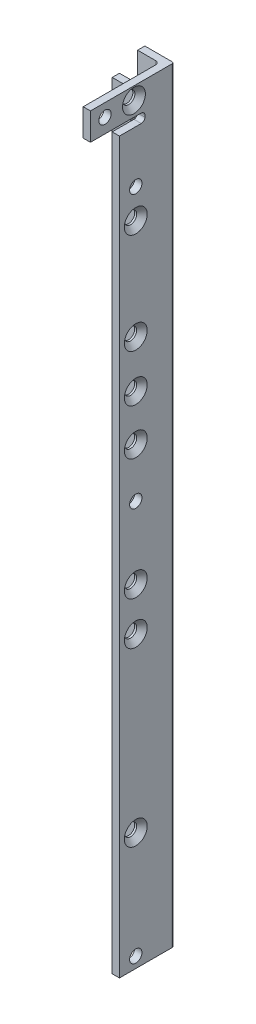
from build123d import *

# Parameters (mm, degrees)
BOSS_EXTRUDE1_DEPTH                             = 211
CSK_FOR_M3_FLAT_HEAD_MACHINE_SCREW1_D           = 3.4
CSK_FOR_M3_FLAT_HEAD_MACHINE_SCREW1_CSINK_D     = 6.3
CSK_FOR_M3_FLAT_HEAD_MACHINE_SCREW1_CSINK_ANGLE = 90
SKETCH5_W                                       = 7
SKETCH5_H                                       = 10
CUT_EXTRUDE1_DEPTH                              = 213.063669684
SKETCH6_W                                       = 7
SKETCH6_H                                       = 2.5
CUT_EXTRUDE2_DEPTH                              = 213.063669684
CSK_FOR_M3_FLAT_HEAD_MACHINE_SCREW2_D           = 3.4
CSK_FOR_M3_FLAT_HEAD_MACHINE_SCREW2_CSINK_D     = 6.3
CSK_FOR_M3_FLAT_HEAD_MACHINE_SCREW2_CSINK_ANGLE = 90
CSK_FOR_M3_FLAT_HEAD_MACHINE_SCREW3_D           = 3.4
CSK_FOR_M3_FLAT_HEAD_MACHINE_SCREW3_CSINK_D     = 6.3
CSK_FOR_M3_FLAT_HEAD_MACHINE_SCREW3_CSINK_ANGLE = 90
FILLET1_R                                       = 0.5
FILLET2_R                                       = 1
CUT_EXTRUDE3_START                              = -10
SKETCH13_R                                      = 1.7
CUT_EXTRUDE3_DEPTH                              = 10
CUT_EXTRUDE4_START                              = -10
SKETCH14_R                                      = 1.7
CUT_EXTRUDE4_DEPTH                              = 10
SKETCH15_W                                      = 2
SKETCH15_H                                      = 7.5
BOSS_EXTRUDE2_DEPTH                             = 8
SKETCH16_R                                      = 1.7
CUT_EXTRUDE5_DEPTH                              = 8


with BuildPart() as part:
    # Sketch1 → Boss-Extrude1 (new body)
    with BuildSketch(Plane(origin=(0, 0, 0), x_dir=(1, 0, 0), z_dir=(0, 1, 0))):
        Polygon((13, 13), (13, 0), (15, 0), (15, 15), (0, 15), (0, 13), align=None)
    extrude(amount=BOSS_EXTRUDE1_DEPTH)

    # CSK for M3 Flat Head Machine Screw1 (through all)
    with Locations(Plane(origin=(15, 0, 0), x_dir=(0, 0, -1), z_dir=(1, 0, 0))):
        with Locations((4.5, 178.5483), (4.5, 150.81169946), (4.5, 137.8117), (4.5, 125.120702), (4.5, 91.71900188), (4.5, 79.860702), (4.5, 32.450702)):
            CounterSinkHole(CSK_FOR_M3_FLAT_HEAD_MACHINE_SCREW1_D / 2, CSK_FOR_M3_FLAT_HEAD_MACHINE_SCREW1_CSINK_D / 2, counter_sink_angle=CSK_FOR_M3_FLAT_HEAD_MACHINE_SCREW1_CSINK_ANGLE)

    # Sketch5 → Cut-Extrude1 (cut, through all)
    with BuildSketch(Plane(origin=(0, 0, -15), x_dir=(-1, 0, 0), z_dir=(0, 0, -1))):
        with Locations((-3.5, 206)):
            Rectangle(SKETCH5_W, SKETCH5_H)
    extrude(amount=-CUT_EXTRUDE1_DEPTH, mode=Mode.SUBTRACT)

    # Sketch6 → Cut-Extrude2 (cut, through all)
    with BuildSketch(Plane(origin=(15, 0, 0), x_dir=(0, 0, -1), z_dir=(1, 0, 0))):
        with Locations((3.5, 202.25)):
            Rectangle(SKETCH6_W, SKETCH6_H)
    extrude(amount=-CUT_EXTRUDE2_DEPTH, mode=Mode.SUBTRACT)

    # CSK for M3 Flat Head Machine Screw2 (through all)
    with Locations(Plane(origin=(15, 0, 0), x_dir=(0, 0, -1), z_dir=(1, 0, 0))):
        with Locations((4, 207.5)):
            CounterSinkHole(CSK_FOR_M3_FLAT_HEAD_MACHINE_SCREW2_D / 2, CSK_FOR_M3_FLAT_HEAD_MACHINE_SCREW2_CSINK_D / 2, counter_sink_angle=CSK_FOR_M3_FLAT_HEAD_MACHINE_SCREW2_CSINK_ANGLE)

    # CSK for M3 Flat Head Machine Screw3 (through all)
    with Locations(Plane(origin=(0, 0, -15), x_dir=(-1, 0, 0), z_dir=(0, 0, -1))):
        with Locations((-4, 3.5), (-4.5, 195)):
            CounterSinkHole(CSK_FOR_M3_FLAT_HEAD_MACHINE_SCREW3_D / 2, CSK_FOR_M3_FLAT_HEAD_MACHINE_SCREW3_CSINK_D / 2, counter_sink_angle=CSK_FOR_M3_FLAT_HEAD_MACHINE_SCREW3_CSINK_ANGLE)

    # Fillet1
    fillet1_edges = [part.edges().sort_by_distance(p)[0] for p in [
        (15, 105.5, -15),
    ]]
    fillet(fillet1_edges, radius=FILLET1_R)

    # Fillet2
    fillet2_edges = [part.edges().sort_by_distance(p)[0] for p in [
        (14, 203.5, -7),
        (14, 201, -7),
        (13, 105.5, -13),
        (7, 201, -14),
    ]]
    fillet(fillet2_edges, radius=FILLET2_R)

    # Sketch13 → Cut-Extrude3 (cut)
    with BuildSketch(Plane(origin=(15, 0, 0), x_dir=(0, 0, -1), z_dir=(1, 0, 0)).offset(CUT_EXTRUDE3_START)):
        with Locations((4.5, 186.68)):
            Circle(SKETCH13_R)
        with Locations((4.5, 111.59)):
            Circle(SKETCH13_R)
        with Locations((4.5, 3)):
            Circle(SKETCH13_R)
        with Locations((4.5, 32.450702)):
            Circle(SKETCH13_R)
    extrude(amount=CUT_EXTRUDE3_DEPTH, mode=Mode.SUBTRACT)

    # Sketch14 → Cut-Extrude4 (cut)
    with BuildSketch(Plane(origin=(0, 0, -15), x_dir=(-1, 0, 0), z_dir=(0, 0, -1)).offset(CUT_EXTRUDE4_START)):
        with Locations((-4.5, 186.68)):
            Circle(SKETCH14_R)
        with Locations((-4.5, 111.59)):
            Circle(SKETCH14_R)
        with Locations((-4.5, 10)):
            Circle(SKETCH14_R)
        with Locations((-4.5, 195)):
            Circle(SKETCH14_R)
    extrude(amount=CUT_EXTRUDE4_DEPTH, mode=Mode.SUBTRACT)

    # Sketch15 → Boss-Extrude2 (add)
    with BuildSketch(Plane.XY):
        with Locations((14, 207.25)):
            Rectangle(SKETCH15_W, SKETCH15_H)
    extrude(amount=BOSS_EXTRUDE2_DEPTH)

    # Sketch16 → Cut-Extrude5 (cut)
    with BuildSketch(Plane.ZY.offset(-13)):
        with Locations((4, 207.5)):
            Circle(SKETCH16_R)
    extrude(amount=-CUT_EXTRUDE5_DEPTH, mode=Mode.SUBTRACT)


solid = part.part
